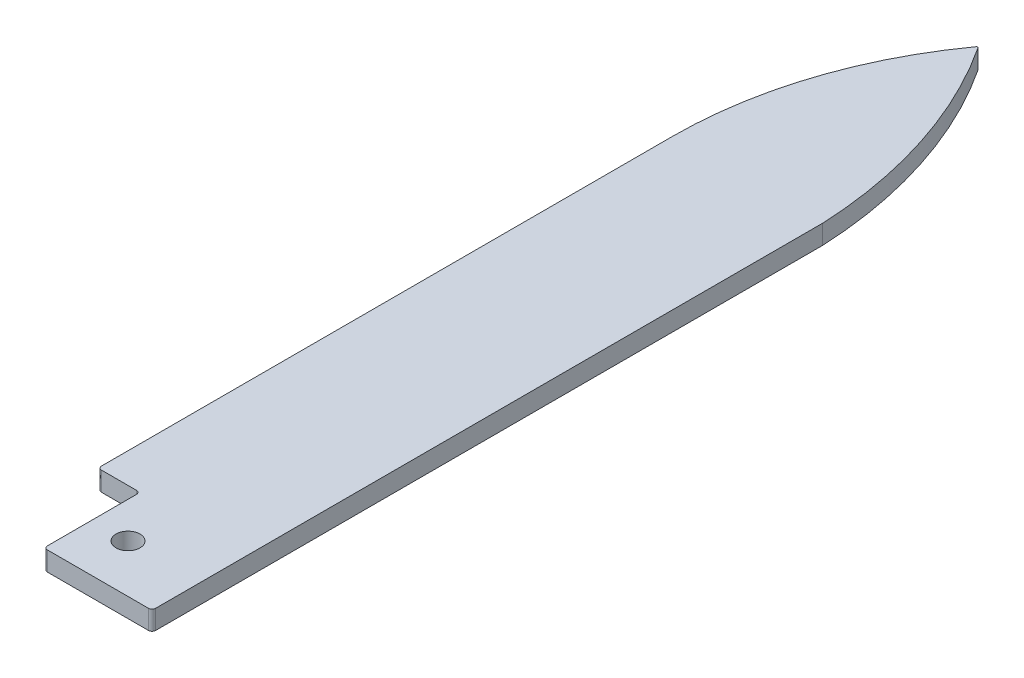
from build123d import *

# Parameters (mm, degrees)
BOSS_EXTRUDE1_DEPTH = 1.6
FILLET1_R           = 0.1
SKETCH2_R           = 1
SKETCH2_W           = 3.5
SKETCH2_H           = 8
CUT_EXTRUDE1_DEPTH  = 76.976566532
FILLET2_R           = 0.3


with BuildPart() as part:
    # Sketch1 → Boss-Extrude1 (new body)
    with BuildSketch(Plane(origin=(0, 0, 0), x_dir=(1, 0, 0), z_dir=(0, 1, 0))):
        with BuildLine():
            Line((0, 0), (0, 55.77852758))
            ThreePointArc((0, 55.77852758), (1.60175081, 65.88455922), (6.25, 75))
            ThreePointArc((6.25, 75), (10.68267286, 65.814463025), (12.5, 55.77852758))
            Line((12.5, 55.77852758), (12.5, 0))
            Line((12.5, 0), (0, 0))
        make_face()
    extrude(amount=BOSS_EXTRUDE1_DEPTH)

    # Fillet1
    fillet1_edges = [part.edges().sort_by_distance(p)[0] for p in [
        (6.25, 0.8, -75),
    ]]
    fillet(fillet1_edges, radius=FILLET1_R)

    # Sketch2 → Cut-Extrude1 (cut, through all)
    with BuildSketch(Plane(origin=(0, 1.6, 0), x_dir=(1, 0, 0), z_dir=(0, 1, 0))):
        with Locations(Location((6.5, 4, 0), (0, 0, 270))):
            Circle(SKETCH2_R)
        with Locations((1.75, 4)):
            Rectangle(SKETCH2_W, SKETCH2_H)
    extrude(amount=-CUT_EXTRUDE1_DEPTH, mode=Mode.SUBTRACT)

    # Fillet2
    fillet2_edges = [part.edges().sort_by_distance(p)[0] for p in [
        (0, 0.8, -8),
        (3.5, 0.8, -8),
        (3.5, 0.8, 0),
        (12.5, 0.8, 0),
    ]]
    fillet(fillet2_edges, radius=FILLET2_R)


solid = part.part
